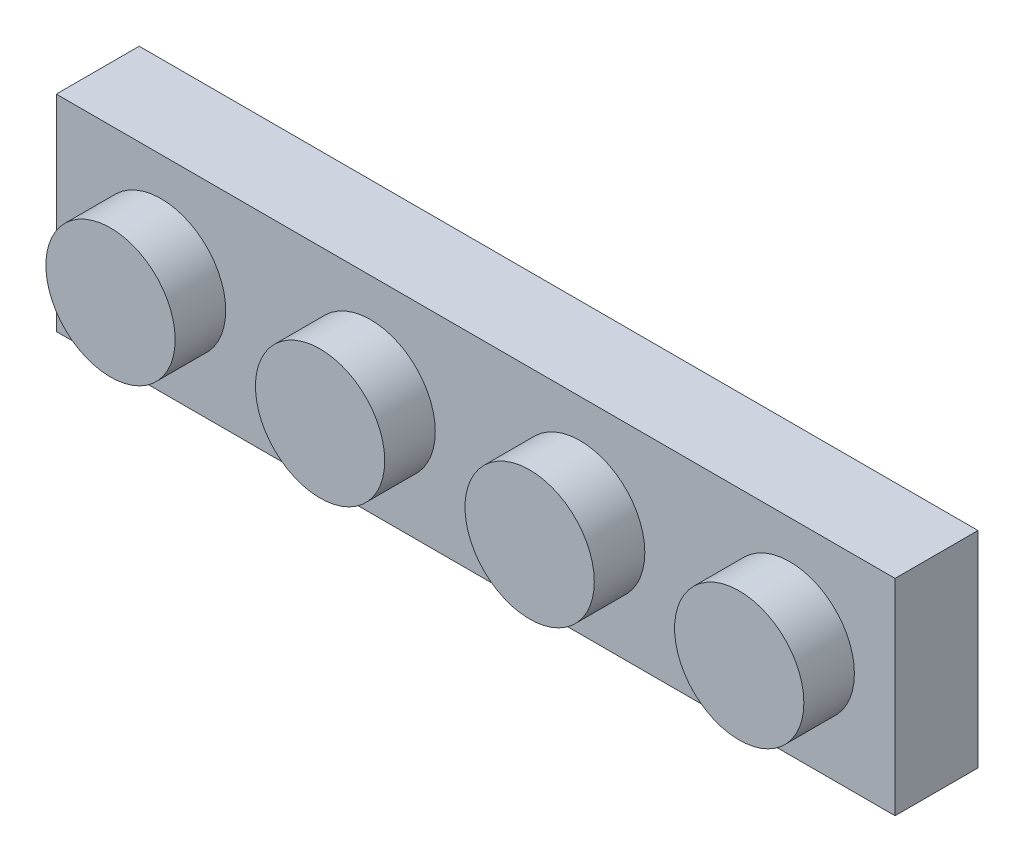
from build123d import *

# Parameters (mm, degrees)
SKETCH1_W           = 31.86
SKETCH1_H           = 7.81
BOSS_EXTRUDE1_DEPTH = 3.15
SKETCH2_R           = 2.455
BOSS_EXTRUDE2_DEPTH = 1.92
SHELL1_T            = -1.5
SKETCH3_R           = 1.485
SKETCH3_R_2         = 0.565
BOSS_EXTRUDE3_DEPTH = 1.45


with BuildPart() as part:
    # Sketch1 → Boss-Extrude1 (new body)
    with BuildSketch(Plane.XY):
        Rectangle(SKETCH1_W, SKETCH1_H)
    extrude(amount=-BOSS_EXTRUDE1_DEPTH)

    # Sketch2 → Boss-Extrude2 (add)
    with BuildSketch(Plane.XY):
        with Locations((-11.95, 0)):
            Circle(SKETCH2_R)
        with Locations((-3.99, 0)):
            Circle(SKETCH2_R)
        with Locations((3.97, 0)):
            Circle(SKETCH2_R)
        with Locations((11.93, 0)):
            Circle(SKETCH2_R)
    extrude(amount=BOSS_EXTRUDE2_DEPTH)

    # Shell1
    shell1_openings = [part.faces().sort_by_distance(p)[0] for p in [
        (0, 0, -3.15),
    ]]
    offset(amount=SHELL1_T, openings=shell1_openings, kind=Kind.INTERSECTION)

    # Sketch3 → Boss-Extrude3 (add)
    # profile 1 of 3: a face of its own
    with BuildSketch(Plane(origin=(0, 0, -1.5), x_dir=(-1, 0, 0), z_dir=(0, 0, -1))):
        with Locations(Location((-7.965, 0, 0), (0, 0, 180))):
            Circle(SKETCH3_R)
        with Locations(Location((-7.965, 0, 0), (0, 0, 180))):
            Circle(SKETCH3_R_2, mode=Mode.SUBTRACT)
    # profile 2 of 3: a face of its own
    with BuildSketch(Plane(origin=(0, 0, -1.5), x_dir=(-1, 0, 0), z_dir=(0, 0, -1))):
        with Locations(Location((0.005, 0, 0), (0, 0, 180))):
            Circle(SKETCH3_R)
        with Locations(Location((0.005, 0, 0), (0, 0, 180))):
            Circle(SKETCH3_R_2, mode=Mode.SUBTRACT)
    # profile 3 of 3: a face of its own
    with BuildSketch(Plane(origin=(0, 0, -1.5), x_dir=(-1, 0, 0), z_dir=(0, 0, -1))):
        with Locations(Location((7.975, 0, 0), (0, 0, 180))):
            Circle(SKETCH3_R)
        with Locations(Location((7.975, 0, 0), (0, 0, 180))):
            Circle(SKETCH3_R_2, mode=Mode.SUBTRACT)
    extrude(amount=BOSS_EXTRUDE3_DEPTH)


solid = part.part
